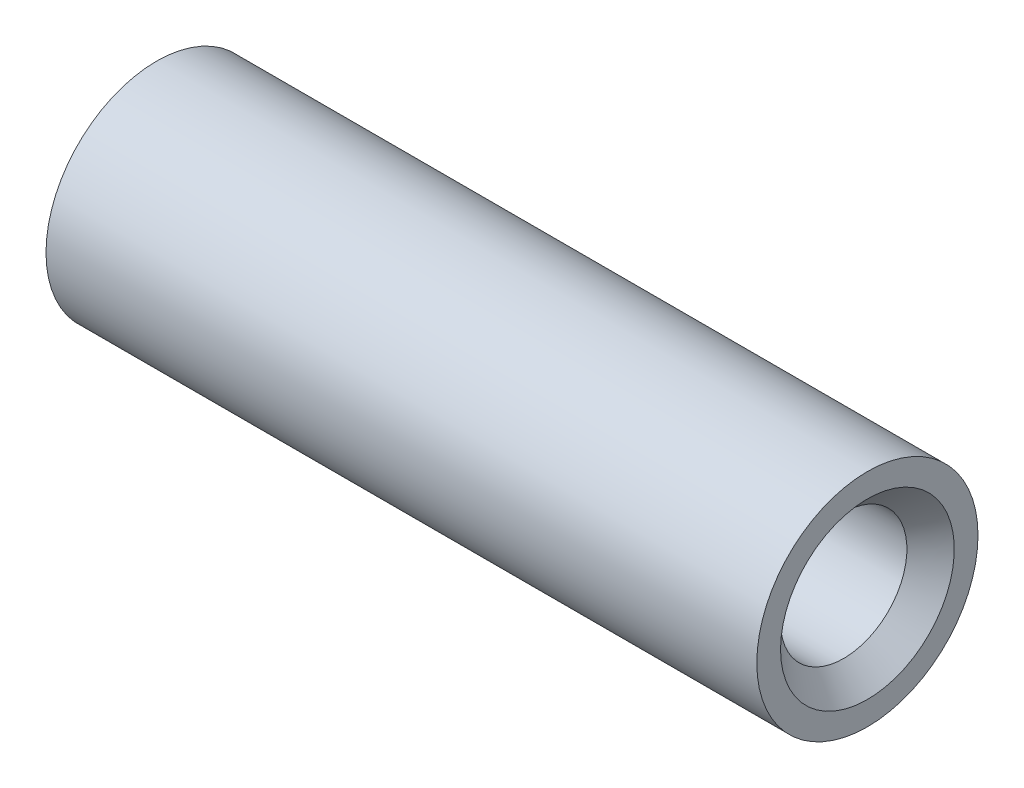
from build123d import *

# Parameters (mm, degrees)
CHAMFER1_SIZE = 1.5


with BuildPart() as part:
    # Sketch1 → Revolve1 (revolve)
    with BuildSketch(Plane.XY, mode=Mode.PRIVATE) as revolve1_sk:
        Polygon((-2.5, 0), (-2.5, 4), (-22.5, 4), (-22.5, 7.00143885), (22.5, 7.00143885), (22.5, 4), (2.5, 4), (2.5, 0), align=None)
    revolve(revolve1_sk.sketch.rotate(Axis((0, 0, 0), (1, 0, 0)), 90), axis=Axis((0, 0, 0), (1, 0, 0)))

    # Chamfer1
    chamfer1_edges = [part.edges().sort_by_distance(p)[0] for p in [
        (22.5, 0, -4),
        (-22.5, 0, -4),
    ]]
    chamfer(chamfer1_edges, length=CHAMFER1_SIZE)


solid = part.part
